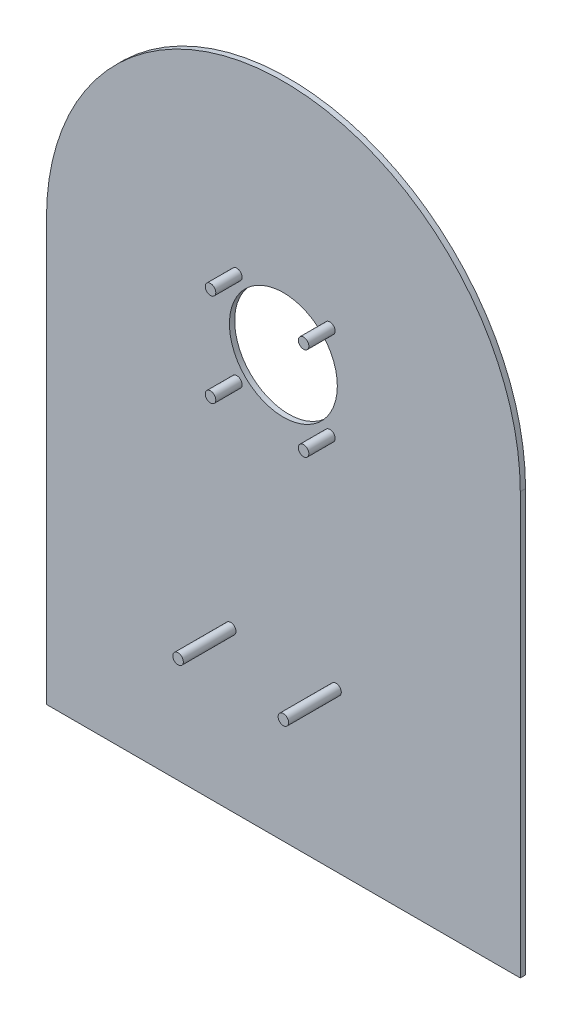
from build123d import *

# Parameters (mm, degrees)
ESQUISSE1_R        = 20.5
BOSS_EXTRU_1_DEPTH = 2
ESQUISSE2_R        = 2
GOUJON_M4X10_DEPTH = 10
ESQUISSE3_R        = 2
GOUJON_M4X20_DEPTH = 20


with BuildPart() as part:
    # Esquisse1 → Boss.-Extru.1 (new body)
    with BuildSketch(Plane.XY):
        with BuildLine():
            Line((-90, -160), (90, -160))
            Line((90, -160), (90, 0))
            ThreePointArc((90, 0), (0, 90), (-90, 0))
            Line((-90, 0), (-90, -160))
        make_face()
        Circle(ESQUISSE1_R, mode=Mode.SUBTRACT)
    extrude(amount=BOSS_EXTRU_1_DEPTH)

    # Esquisse2 → Goujon M4x10 (add)
    with BuildSketch(Plane.XY.offset(2)):
        with Locations((-17.67766953, 17.67766953)):
            Circle(ESQUISSE2_R)
        with Locations((17.67766953, 17.67766953)):
            Circle(ESQUISSE2_R)
        with Locations((17.67766953, -17.67766953)):
            Circle(ESQUISSE2_R)
        with Locations((-17.67766953, -17.67766953)):
            Circle(ESQUISSE2_R)
    extrude(amount=GOUJON_M4X10_DEPTH)

    # Esquisse3 → Goujon M4x20 (add)
    with BuildSketch(Plane.XY.offset(2)):
        with Locations((-20, -100)):
            Circle(ESQUISSE3_R)
        with Locations((20, -100)):
            Circle(ESQUISSE3_R)
    extrude(amount=GOUJON_M4X20_DEPTH)


solid = part.part
